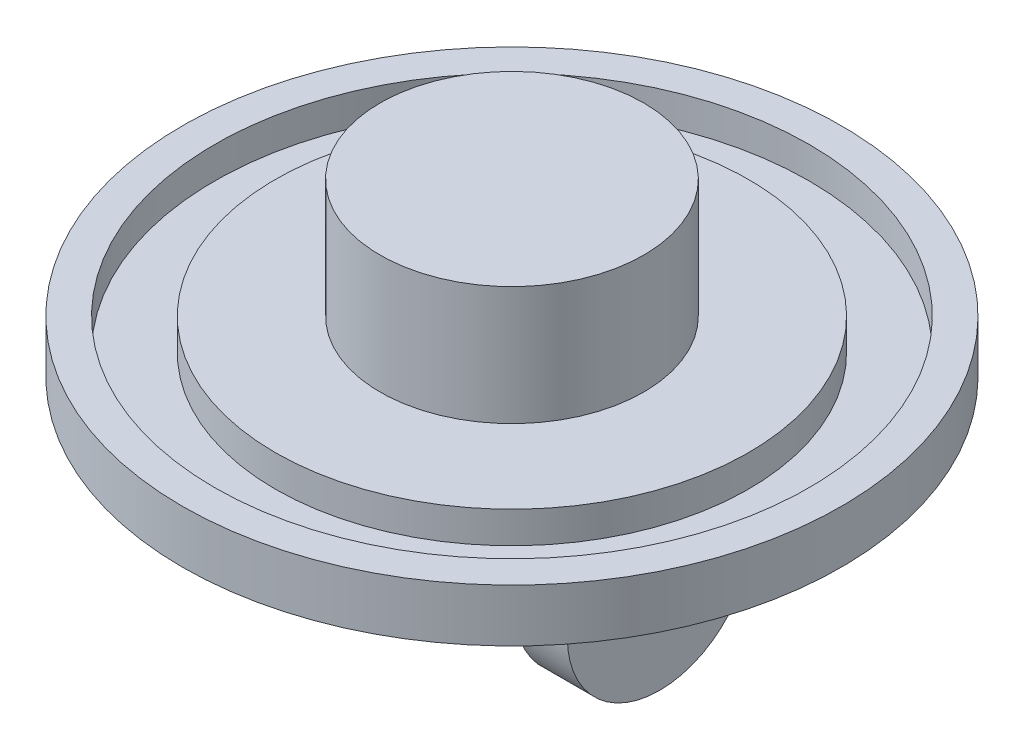
from build123d import *

# Parameters (mm, degrees)
SKIZZE1_R                       = 125
AUFSATZ_LINEAR_AUSTRAGEN1_DEPTH = 20
SKIZZE2_R                       = 50
AUFSATZ_LINEAR_AUSTRAGEN2_DEPTH = 45
SKIZZE3_W                       = 20
SKIZZE3_H                       = 70
AUFSATZ_LINEAR_AUSTRAGEN3_DEPTH = 75
SCHNITT_LINEAR_AUSTRAGEN1_REACH = 234.403
SKIZZE5_R                       = 112.75
SKIZZE5_R_2                     = 89.75
SCHNITT_LINEAR_AUSTRAGEN2_DEPTH = 12
SKIZZE6_R                       = 15
SCHNITT_LINEAR_AUSTRAGEN3_DEPTH = 6
SKIZZE7_R                       = 6
SCHNITT_LINEAR_AUSTRAGEN4_DEPTH = 50


with BuildPart() as part:
    # Skizze1 → Aufsatz-Linear austragen1 (new body)
    with BuildSketch(Plane(origin=(0, 0, 0), x_dir=(1, 0, 0), z_dir=(0, 1, 0))):
        with Locations(Location((0, 0, 0), (0, 0, 270))):
            Circle(SKIZZE1_R)
    extrude(amount=AUFSATZ_LINEAR_AUSTRAGEN1_DEPTH)

    # Skizze2 → Aufsatz-Linear austragen2 (add)
    with BuildSketch(Plane(origin=(0, 20, 0), x_dir=(1, 0, 0), z_dir=(0, 1, 0))):
        with Locations(Location((0, 0, 0), (0, 0, 90))):
            Circle(SKIZZE2_R)
    extrude(amount=AUFSATZ_LINEAR_AUSTRAGEN2_DEPTH)

    # Skizze3 → Aufsatz-Linear austragen3 (add)
    with BuildSketch(Plane.XZ):
        with Locations((-46, 0)):
            Rectangle(SKIZZE3_W, SKIZZE3_H)
        with Locations((46, 0)):
            Rectangle(SKIZZE3_W, SKIZZE3_H)
    extrude(amount=AUFSATZ_LINEAR_AUSTRAGEN3_DEPTH)

    # Schnitt-Linear austragen1: up to this face of the body (flat: up to its plane)
    schnitt_linear_austragen1_end = Plane(part.part.faces().sort_by_distance((56, -37.5, 0))[0])
    # Skizze4 → Schnitt-Linear austragen1 (cut, up to the picked face)
    with BuildSketch(Plane.ZY.offset(56), mode=Mode.PRIVATE) as schnitt_linear_austragen1_sk1:
        with BuildLine():
            ThreePointArc((0, -75), (-24.748737342, -64.748737342), (-35, -40))
            Line((-35, -40), (-35, -75))
            Line((-35, -75), (0, -75))
        make_face()
    schnitt_linear_austragen1_tool1 = split(extrude(schnitt_linear_austragen1_sk1.sketch, amount=-SCHNITT_LINEAR_AUSTRAGEN1_REACH, mode=Mode.PRIVATE), bisect_by=schnitt_linear_austragen1_end, keep=Keep.BOTH, mode=Mode.PRIVATE)
    # Skizze4 → Schnitt-Linear austragen1 (cut, up to the picked face)
    with BuildSketch(Plane.ZY.offset(56), mode=Mode.PRIVATE) as schnitt_linear_austragen1_sk2:
        with BuildLine():
            Line((35, -75), (35, -40))
            ThreePointArc((35, -40), (24.748737342, -64.748737342), (0, -75))
            Line((0, -75), (35, -75))
        make_face()
    schnitt_linear_austragen1_tool2 = split(extrude(schnitt_linear_austragen1_sk2.sketch, amount=-SCHNITT_LINEAR_AUSTRAGEN1_REACH, mode=Mode.PRIVATE), bisect_by=schnitt_linear_austragen1_end, keep=Keep.BOTH, mode=Mode.PRIVATE)
    add(schnitt_linear_austragen1_tool1.solids().sort_by(Axis((-56, -67.182122, -27.182122), (1, 0, 0)))[0], mode=Mode.SUBTRACT)
    add(schnitt_linear_austragen1_tool2.solids().sort_by(Axis((-56, -67.182122, 27.182122), (1, 0, 0)))[0], mode=Mode.SUBTRACT)

    # Skizze5 → Schnitt-Linear austragen2 (cut)
    with BuildSketch(Plane(origin=(0, 20, 0), x_dir=(1, 0, 0), z_dir=(0, 1, 0))):
        with Locations(Location((0, 0, 0), (0, 0, 270))):
            Circle(SKIZZE5_R)
        with Locations(Location((0, 0, 0), (0, 0, 270))):
            Circle(SKIZZE5_R_2, mode=Mode.SUBTRACT)
    extrude(amount=-SCHNITT_LINEAR_AUSTRAGEN2_DEPTH, mode=Mode.SUBTRACT)

    # Skizze6 → Schnitt-Linear austragen3 (cut)
    with BuildSketch(Plane.XZ):
        with Locations(Location((0, 0, 0), (0, 0, 270))):
            Circle(SKIZZE6_R)
    extrude(amount=-SCHNITT_LINEAR_AUSTRAGEN3_DEPTH, mode=Mode.SUBTRACT)

    # Skizze7 → Schnitt-Linear austragen4 (cut)
    with BuildSketch(Plane(origin=(0, 6, 0), x_dir=(-1, 0, 0), z_dir=(0, -1, 0))):
        with Locations(Location((0, 0, 0), (0, 0, 90))):
            Circle(SKIZZE7_R)
    extrude(amount=-SCHNITT_LINEAR_AUSTRAGEN4_DEPTH, mode=Mode.SUBTRACT)


solid = part.part
